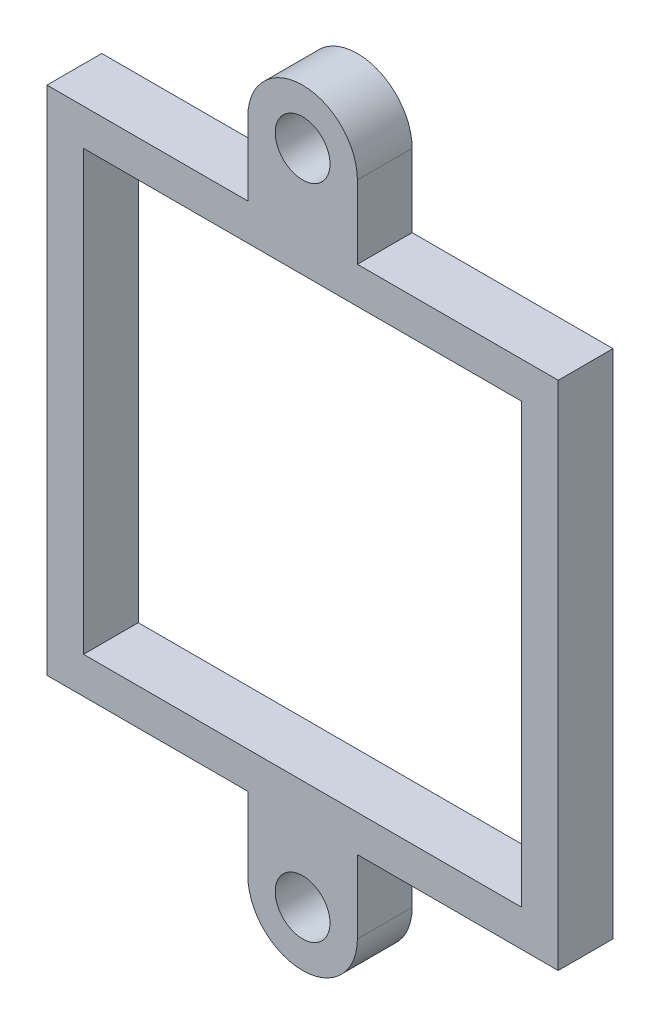
from build123d import *

# Parameters (mm, degrees)
SKETCH_6_W          = 14
SKETCH_6_H          = 14
SKETCH_6_W_2        = 12
SKETCH_6_H_2        = 12
EXTRUDE_3_DEPTH     = 1.5
SKETCH_7_W          = 3
SKETCH_7_H          = 1.5
EXTRUDE_4_DEPTH     = 3.5
CUT_EXTRUDE_3_DEPTH = 4
SKETCH_11_R         = 0.75
CUT_EXTRUDE_5_DEPTH = 4


with BuildPart() as part:
    # 草图6 → 凸台-拉伸3 (new body)
    with BuildSketch(Plane.XY):
        Rectangle(SKETCH_6_W, SKETCH_6_H)
        Rectangle(SKETCH_6_W_2, SKETCH_6_H_2, mode=Mode.SUBTRACT)
    extrude(amount=EXTRUDE_3_DEPTH)

    # 草图7 → 凸台-拉伸4 (add)
    with BuildSketch(Plane.XZ.offset(7)):
        with Locations((0, 0.75)):
            Rectangle(SKETCH_7_W, SKETCH_7_H)
    extrude_4 = extrude(amount=EXTRUDE_4_DEPTH)

    # 草图8 → 切除-拉伸3 (cut)
    with BuildSketch(Plane.XY.offset(1.5)):
        with BuildLine():
            ThreePointArc((0, -10.5), (-1.060660172, -10.060660172), (-1.5, -9))
            Line((-1.5, -9), (-1.5, -10.5))
            Line((-1.5, -10.5), (0, -10.5))
        make_face()
        with BuildLine():
            Line((1.5, -10.5), (1.5, -9))
            ThreePointArc((1.5, -9), (1.060660172, -10.060660172), (0, -10.5))
            Line((0, -10.5), (1.5, -10.5))
        make_face()
    cut_extrude_3 = extrude(amount=-CUT_EXTRUDE_3_DEPTH, mode=Mode.SUBTRACT)

    # 草图11 → 切除-拉伸5 (cut)
    with BuildSketch(Plane.XY.offset(1.5)):
        with Locations((0, -9)):
            Circle(SKETCH_11_R)
    cut_extrude_5 = extrude(amount=-CUT_EXTRUDE_5_DEPTH, mode=Mode.SUBTRACT)

    # 镜向1: 凸台-拉伸4, 切除-拉伸3, 切除-拉伸5 across plane
    add(extrude_4.mirror(Plane.ZX))
    add(cut_extrude_3.mirror(Plane.ZX), mode=Mode.SUBTRACT)
    add(cut_extrude_5.mirror(Plane.ZX), mode=Mode.SUBTRACT)


solid = part.part
